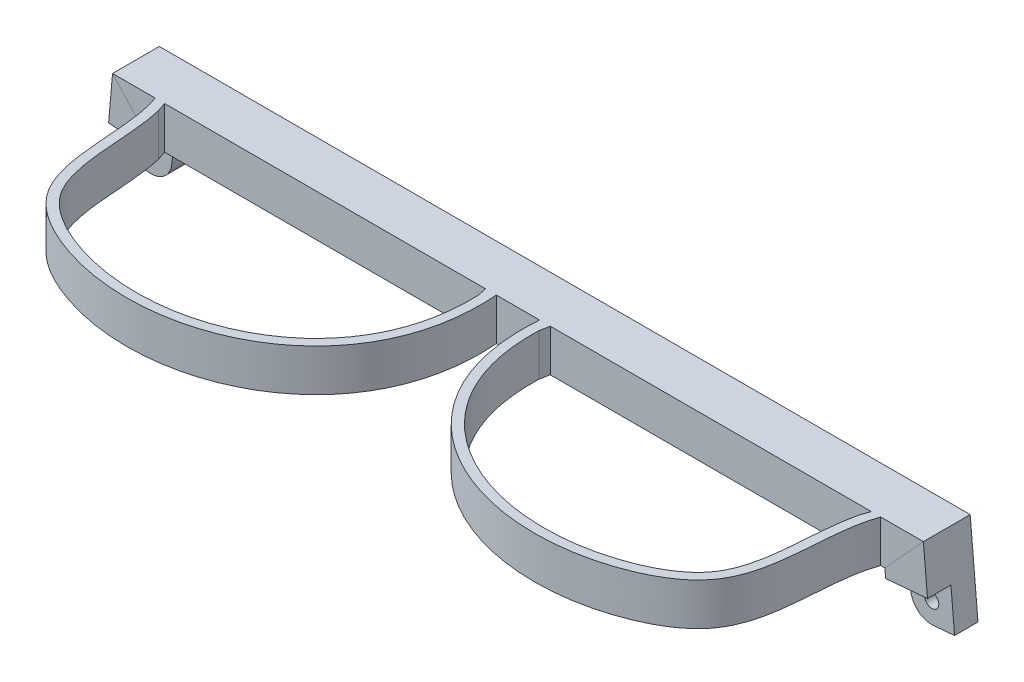
from build123d import *

# Parameters (mm, degrees)
FRAME_DEPTH            = 9
SKETCH_1035_W          = 10
SKETCH_1035_H          = 9
CONNECTION_2_DEPTH     = 103.044080854
SKETCH_23_W            = 10
SKETCH_23_H            = 9
SKETCH_24_R            = 1.5
AND_CONNECTION_DEPTH   = 103.044080854
SKETCH_25_W            = 6
SKETCH_25_H            = 7.2
CUT_EXTRUDE_2672_DEPTH = 77.5
SKETCH_25_2_W          = 6
SKETCH_25_2_H          = 7.2
CUT_EXTRUDE_2725_DEPTH = 77.5
SKETCH_1600_R          = 1.5
CUT_EXTRUDE_3038_DEPTH = 103.004936699
CONNECTION_4_DEPTH     = 5
CUT_EXTRUDE_4_DEPTH    = 5


with BuildPart() as part:
    # 草图1 → frame (new body)
    with BuildSketch(Plane(origin=(0, 0, 0), x_dir=(1, 0, 0), z_dir=(0, 1, 0))):
        with BuildLine():
            Line((77.5, 21.66163142), (-77.5, 21.66163142))
            Line((-77.5, 21.66163142), (-77.5, 11.66163142))
            add(Edge.make_bspline(
                [(-77.5, 11.66163142), (-74.407700798, 3.186863233), (-78.13080327, -15.927288699), (-40.25886312, -37.426028597), (-2.116282918, -20.689046368), (-4.622356495, 11.66163142)],
                knots=[0, 0, 0, 0, 0.2461215, 0.369792099, 1, 1, 1, 1], degree=3))
            Line((-4.622356495, 11.66163142), (4.622356495, 11.66163142))
            add(Edge.make_bspline(
                [(77.5, 11.66163142), (74.407700798, 3.186863233), (78.13080327, -15.927288699), (40.25886312, -37.426028597), (2.116282918, -20.689046368), (4.622356495, 11.66163142)],
                knots=[0, 0, 0, 0, 0.2461215, 0.369792099, 1, 1, 1, 1], degree=3))
            Line((77.5, 11.66163142), (77.5, 21.66163142))
        make_face()
        with BuildLine():
            Line((6.907388487, 11.66163142), (75.498489426, 11.66163142))
            Line((75.498489426, 11.66163142), (74.826320569, 9.66163142))
            add(Edge.make_bspline(
                [(74.826320569, 9.66163142), (74.537129512, 8.440205397), (74.118616889, 5.97852646), (73.621822389, 0.86906895), (73.254603503, -5.556962308), (72.241025744, -11.370637322), (70.601393479, -15.207799235), (68.270143007, -18.43048657), (63.731478169, -21.762919869), (56.85425746, -24.533410045), (49.722568077, -26.119696622), (40.058249914, -26.656581209), (30.63607695, -24.877975202), (22.314225365, -20.908251341), (16.828859323, -16.874650673), (12.291217041, -11.816635216), (9.449850549, -6.759991518), (7.834253455, -2.202532167), (6.977086921, 1.473147324), (6.581231794, 4.759863142), (6.469661343, 7.510165764), (6.485645336, 8.950311376), (6.511310136, 9.66163142)],
                knots=[0.022831488, 0.022831488, 0.022831488, 0.022831488, 0.052972273, 0.083113058, 0.143394628, 0.203676198, 0.233816983, 0.263957769, 0.324239339, 0.384520909, 0.444802479, 0.505084049, 0.625647189, 0.685928759, 0.746210329, 0.806491899, 0.866773469, 0.896914254, 0.92705504, 0.957195825, 0.972266217, 0.98733661, 0.98733661, 0.98733661, 0.98733661], degree=3))
            Line((6.511310136, 9.66163142), (6.907388487, 11.66163142))
        make_face(mode=Mode.SUBTRACT)
        with BuildLine():
            Line((-75.498489426, 11.66163142), (-6.907388487, 11.66163142))
            Line((-6.907388487, 11.66163142), (-6.511310136, 9.66163142))
            add(Edge.make_bspline(
                [(-74.826320569, 9.66163142), (-74.537129512, 8.440205397), (-74.118616889, 5.97852646), (-73.621822389, 0.86906895), (-73.254603503, -5.556962308), (-72.241025744, -11.370637322), (-70.601393479, -15.207799235), (-68.270143007, -18.43048657), (-63.731478169, -21.762919869), (-56.85425746, -24.533410045), (-49.722568077, -26.119696622), (-40.058249914, -26.656581209), (-30.63607695, -24.877975202), (-22.314225365, -20.908251341), (-16.828859323, -16.874650673), (-12.291217041, -11.816635216), (-9.449850549, -6.759991518), (-7.834253455, -2.202532167), (-6.977086921, 1.473147324), (-6.581231794, 4.759863142), (-6.469661343, 7.510165764), (-6.485645336, 8.950311376), (-6.511310136, 9.66163142)],
                knots=[0.022831488, 0.022831488, 0.022831488, 0.022831488, 0.052972273, 0.083113058, 0.143394628, 0.203676198, 0.233816983, 0.263957769, 0.324239339, 0.384520909, 0.444802479, 0.505084049, 0.625647189, 0.685928759, 0.746210329, 0.806491899, 0.866773469, 0.896914254, 0.92705504, 0.957195825, 0.972266217, 0.98733661, 0.98733661, 0.98733661, 0.98733661], degree=3))
            Line((-74.826320569, 9.66163142), (-75.498489426, 11.66163142))
        make_face(mode=Mode.SUBTRACT)
    extrude(amount=FRAME_DEPTH)

    # connection: sweep along a path in Sketch 1207
    with BuildLine(Plane(origin=(0, 0, -16.66163142), x_dir=(-1, 0, 0), z_dir=(0, 0, -1))) as connection_path:
        Line((-77.5, 4.5), (-82.5, 4.5))
        Line((-82.5, 4.5), (-83.807336141, -10.442920471))
    # Sketch 1035 → connection (sweep)
    with BuildSketch(Plane(origin=(77.5, 0, 0), x_dir=(0, 0, -1), z_dir=(1, 0, 0))):
        with Locations((16.66163142, 4.5)):
            Rectangle(SKETCH_1035_W, SKETCH_1035_H)
    sweep(path=connection_path.line, transition=Transition.RIGHT)

    # 草图20 → connection 2 (cut, through all)
    with BuildSketch(Plane(origin=(0, 0, -21.66163142), x_dir=(-1, 0, 0), z_dir=(0, 0, -1))):
        with BuildLine():
            Line((-79.32446, -10.835121314), (-83.807336141, -10.442920471))
            ThreePointArc((-83.807336141, -10.442920471), (-80.522591055, -9.407244324), (-78.932259157, -6.352245172))
            Line((-78.932259157, -6.352245172), (-79.32446, -10.835121314))
        make_face()
    extrude(amount=-CONNECTION_2_DEPTH, mode=Mode.SUBTRACT)

    # connection 3: sweep along a path in 草图22
    with BuildLine(Plane(origin=(0, 0, -16.66163142), x_dir=(-1, 0, 0), z_dir=(0, 0, -1))) as connection_3_path:
        Line((77.5, 4.5), (82.5, 4.5))
        Line((82.5, 4.5), (83.807336141, -10.442920471))
    # 草图23 → connection 3 (sweep)
    with BuildSketch(Plane.ZY.offset(77.5)):
        with Locations((-16.66163142, 4.5)):
            Rectangle(SKETCH_23_W, SKETCH_23_H)
    sweep(path=connection_3_path.line, transition=Transition.RIGHT)

    # 草图24 → 右侧孔and_connection圆角化 (cut, through all)
    with BuildSketch(Plane(origin=(0, 0, -21.66163142), x_dir=(-1, 0, 0), z_dir=(0, 0, -1))):
        with Locations((83.415135299, -5.96004433)):
            Circle(SKETCH_24_R)
        with BuildLine():
            Line((79.32446, -10.835121314), (83.807336141, -10.442920471))
            ThreePointArc((83.807336141, -10.442920471), (80.522591055, -9.407244324), (78.932259157, -6.352245172))
            Line((78.932259157, -6.352245172), (79.32446, -10.835121314))
        make_face()
    extrude(amount=-AND_CONNECTION_DEPTH, mode=Mode.SUBTRACT)

    # 草图25 → Cut-Extrude 2672 (cut)
    with BuildSketch(Plane(origin=(0, 0, 0), x_dir=(0, 0, -1), z_dir=(1, 0, 0))):
        with Locations((16.66163142, 3.6)):
            Rectangle(SKETCH_25_W, SKETCH_25_H)
    extrude(amount=-CUT_EXTRUDE_2672_DEPTH, mode=Mode.SUBTRACT)

    # 草图25<2> → Cut-Extrude 2725 (cut)
    with BuildSketch(Plane(origin=(0, 0, 0), x_dir=(0, 0, -1), z_dir=(1, 0, 0))):
        with Locations((16.66163142, 3.6)):
            Rectangle(SKETCH_25_2_W, SKETCH_25_2_H)
    extrude(amount=CUT_EXTRUDE_2725_DEPTH, mode=Mode.SUBTRACT)

    # Sketch 1600 → Cut-Extrude 3038 (cut, through all)
    with BuildSketch(Plane(origin=(0, 0, -21.66163142), x_dir=(-1, 0, 0), z_dir=(0, 0, -1))):
        with Locations((-83.415135299, -5.96004433)):
            Circle(SKETCH_1600_R)
    extrude(amount=-CUT_EXTRUDE_3038_DEPTH, mode=Mode.SUBTRACT)

    # 草图27 → connection 4 (cut)
    with BuildSketch(Plane(origin=(0, 0, -16.66163142), x_dir=(-1, 0, 0), z_dir=(0, 0, -1))):
        with BuildLine():
            Line((-87.505810598, -1.084967346), (-78.540058315, -1.869369031))
            Line((-78.540058315, -1.869369031), (-78.932259157, -6.352245172))
            ThreePointArc((-78.932259157, -6.352245172), (-80.522591055, -9.407244324), (-83.807336141, -10.442920471))
            Line((-83.807336141, -10.442920471), (-88.290212283, -10.050719629))
            Line((-88.290212283, -10.050719629), (-87.505810598, -1.084967346))
        make_face()
    extrude(amount=-CONNECTION_4_DEPTH, mode=Mode.SUBTRACT)

    # 草图30 → 切除-拉伸4 (cut)
    with BuildSketch(Plane(origin=(0, 0, -16.66163142), x_dir=(-1, 0, 0), z_dir=(0, 0, -1))):
        with BuildLine():
            Line((88.290212283, -10.050719629), (83.807336141, -10.442920471))
            ThreePointArc((83.807336141, -10.442920471), (80.522591055, -9.407244324), (78.932259157, -6.352245172))
            Line((78.932259157, -6.352245172), (78.494187368, -1.345061709))
            Line((78.494187368, -1.345061709), (87.459939651, -0.560660024))
            Line((87.459939651, -0.560660024), (88.290212283, -10.050719629))
        make_face()
    extrude(amount=-CUT_EXTRUDE_4_DEPTH, mode=Mode.SUBTRACT)


solid = part.part
